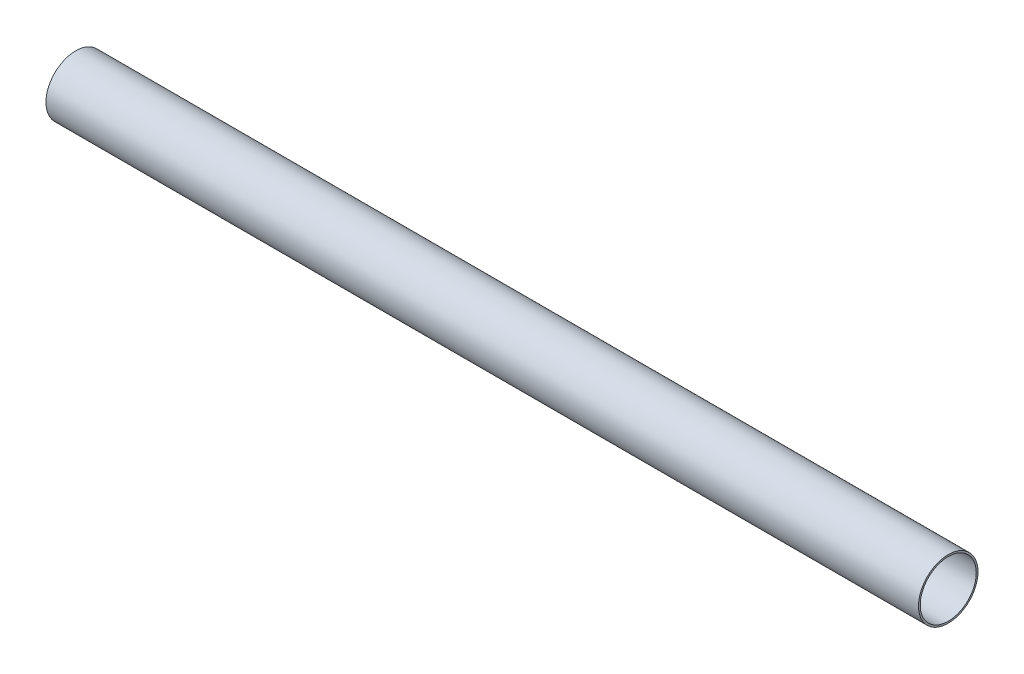
from build123d import *

# Parameters (mm, degrees)
BOSS_EXTRUDE1_DEPTH      = 2500
BOSS_EXTRUDE1_DEPTH_BACK = 2500
SKETCH1_R                = 170.5
SHELL1_T                 = -10


with BuildPart() as part:
    # Sketch1 → Boss-Extrude1 (new, two sides: drawn at the far end of the back side and taken through both)
    with BuildSketch(Plane.YZ.offset(-BOSS_EXTRUDE1_DEPTH_BACK)):
        Circle(SKETCH1_R)
    extrude(amount=BOSS_EXTRUDE1_DEPTH + BOSS_EXTRUDE1_DEPTH_BACK)

    # Shell1
    shell1_openings = [part.faces().sort_by_distance(p)[0] for p in [
        (-2500, 0, 0),
        (2500, 0, 0),
    ]]
    offset(amount=SHELL1_T, openings=shell1_openings, kind=Kind.INTERSECTION)


solid = part.part
